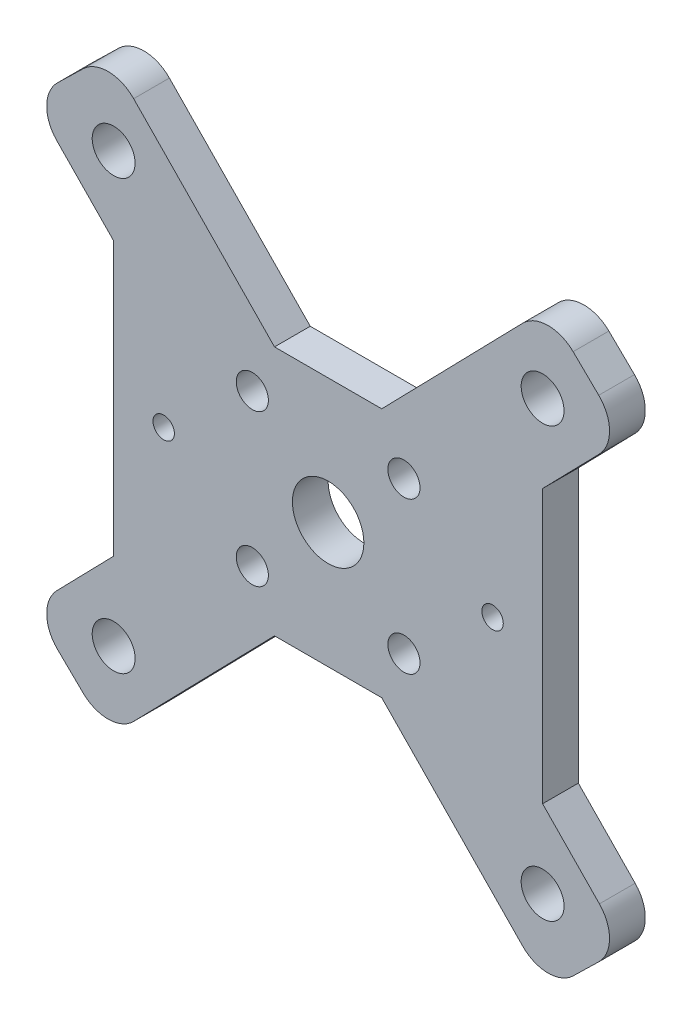
from build123d import *

# Parameters (mm, degrees)
ESQUISSE1_R        = 8
ESQUISSE1_R_2      = 2.25
BOSS_EXTRU_1_DEPTH = 5
BOSS_EXTRU_2_START = -5
ESQUISSE2_R        = 3
BOSS_EXTRU_2_DEPTH = 5
BOSS_EXTRU_3_START = -5
ESQUISSE3_R        = 1.5
ESQUISSE3_R_2      = 8
ESQUISSE3_R_3      = 5
BOSS_EXTRU_3_DEPTH = 5


with BuildPart() as part:
    # Esquisse1 → Boss.-Extru.1 (new body)
    with BuildSketch(Plane.XY):
        with BuildLine():
            Line((7.5, -17.5), (-7.5, -17.5))
            ThreePointArc((-7.5, -17.5), (-14.571067812, -14.571067812), (-17.5, -7.5))
            Line((-17.5, -7.5), (-17.5, 7.5))
            ThreePointArc((-17.5, 7.5), (-14.571067812, 14.571067812), (-7.5, 17.5))
            Line((-7.5, 17.5), (7.5, 17.5))
            ThreePointArc((7.5, 17.5), (14.571067812, 14.571067812), (17.5, 7.5))
            Line((17.5, 7.5), (17.5, -7.5))
            ThreePointArc((17.5, -7.5), (14.571067812, -14.571067812), (7.5, -17.5))
        make_face()
        Circle(ESQUISSE1_R, mode=Mode.SUBTRACT)
        with Locations((-10.605, 10.605)):
            Circle(ESQUISSE1_R_2, mode=Mode.SUBTRACT)
        with Locations((10.605, 10.605)):
            Circle(ESQUISSE1_R_2, mode=Mode.SUBTRACT)
        with Locations((-10.605, -10.605)):
            Circle(ESQUISSE1_R_2, mode=Mode.SUBTRACT)
        with Locations((10.605, -10.605)):
            Circle(ESQUISSE1_R_2, mode=Mode.SUBTRACT)
    extrude(amount=BOSS_EXTRU_1_DEPTH)

    # Esquisse2 → Boss.-Extru.2 (add)
    # profile 1 of 4: a face of its own
    with BuildSketch(Plane.XY.offset(5).offset(BOSS_EXTRU_2_START)):
        with BuildLine():
            Line((-37.944507823, 27.247644267), (-17.5, 6.269167951))
            Line((-17.5, 6.269167951), (-17.5, 7.5))
            ThreePointArc((-17.5, 7.5), (-14.571067812, 14.571067812), (-7.5, 17.5))
            Line((-7.5, 17.5), (-27.202072783, 37.7166504))
            ThreePointArc((-27.202072783, 37.7166504), (-30.718436651, 39.22656632), (-34.272553174, 37.807793369))
            Line((-34.272553174, 37.807793369), (-37.853364854, 34.318124658))
            ThreePointArc((-37.853364854, 34.318124658), (-39.363280773, 30.80176079), (-37.944507823, 27.247644267))
        make_face()
        with Locations((-30, 30)):
            Circle(ESQUISSE2_R, mode=Mode.SUBTRACT)
    # profile 2 of 4: a face of its own
    with BuildSketch(Plane.XY.offset(5).offset(BOSS_EXTRU_2_START)):
        with BuildLine():
            ThreePointArc((37.944507823, 27.247644267), (39.363280773, 30.80176079), (37.853364854, 34.318124658))
            Line((37.853364854, 34.318124658), (34.272553174, 37.807793369))
            ThreePointArc((34.272553174, 37.807793369), (30.718436651, 39.22656632), (27.202072783, 37.7166504))
            Line((27.202072783, 37.7166504), (7.5, 17.5))
            ThreePointArc((7.5, 17.5), (14.571067812, 14.571067812), (17.5, 7.5))
            Line((17.5, 7.5), (17.5, 6.269167951))
            Line((17.5, 6.269167951), (37.944507823, 27.247644267))
        make_face()
        with Locations((30, 30)):
            Circle(ESQUISSE2_R, mode=Mode.SUBTRACT)
    # profile 3 of 4: a face of its own
    with BuildSketch(Plane.XY.offset(5).offset(BOSS_EXTRU_2_START)):
        with BuildLine():
            Line((37.944507823, -27.247644267), (17.5, -6.269167951))
            Line((17.5, -6.269167951), (17.5, -7.5))
            ThreePointArc((17.5, -7.5), (14.571067812, -14.571067812), (7.5, -17.5))
            Line((7.5, -17.5), (27.202072783, -37.7166504))
            ThreePointArc((27.202072783, -37.7166504), (30.718436651, -39.22656632), (34.272553174, -37.807793369))
            Line((34.272553174, -37.807793369), (37.853364854, -34.318124658))
            ThreePointArc((37.853364854, -34.318124658), (39.363280773, -30.80176079), (37.944507823, -27.247644267))
        make_face()
        with Locations((30, -30)):
            Circle(ESQUISSE2_R, mode=Mode.SUBTRACT)
    # profile 4 of 4: a face of its own
    with BuildSketch(Plane.XY.offset(5).offset(BOSS_EXTRU_2_START)):
        with BuildLine():
            Line((-17.5, -7.5), (-17.5, -6.269167951))
            Line((-17.5, -6.269167951), (-37.944507823, -27.247644267))
            ThreePointArc((-37.944507823, -27.247644267), (-39.363280773, -30.80176079), (-37.853364854, -34.318124658))
            Line((-37.853364854, -34.318124658), (-34.272553174, -37.807793369))
            ThreePointArc((-34.272553174, -37.807793369), (-30.718436651, -39.22656632), (-27.202072783, -37.7166504))
            Line((-27.202072783, -37.7166504), (-7.5, -17.5))
            ThreePointArc((-7.5, -17.5), (-14.571067812, -14.571067812), (-17.5, -7.5))
        make_face()
        with Locations((-30, -30)):
            Circle(ESQUISSE2_R, mode=Mode.SUBTRACT)
    extrude(amount=BOSS_EXTRU_2_DEPTH)

    # Esquisse3 → Boss.-Extru.3 (add)
    # profile 1 of 3: a face of its own
    with BuildSketch(Plane.XY.offset(5).offset(BOSS_EXTRU_3_START)):
        Polygon((17.5, 6.269167951), (17.5, -6.269167951), (30, -19.095642241), (30, 19.095642241), align=None)
        with Locations((23, 0)):
            Circle(ESQUISSE3_R, mode=Mode.SUBTRACT)
    # profile 2 of 3: a face of its own
    with BuildSketch(Plane.XY.offset(5).offset(BOSS_EXTRU_3_START)):
        Polygon((-30, -19.095642241), (-17.5, -6.269167951), (-17.5, 6.269167951), (-30, 19.095642241), align=None)
        with Locations((-23, 0)):
            Circle(ESQUISSE3_R, mode=Mode.SUBTRACT)
    # profile 3 of 3: a face of its own
    with BuildSketch(Plane.XY.offset(5).offset(BOSS_EXTRU_3_START)):
        Circle(ESQUISSE3_R_2)
        Circle(ESQUISSE3_R_3, mode=Mode.SUBTRACT)
    extrude(amount=BOSS_EXTRU_3_DEPTH)


solid = part.part
